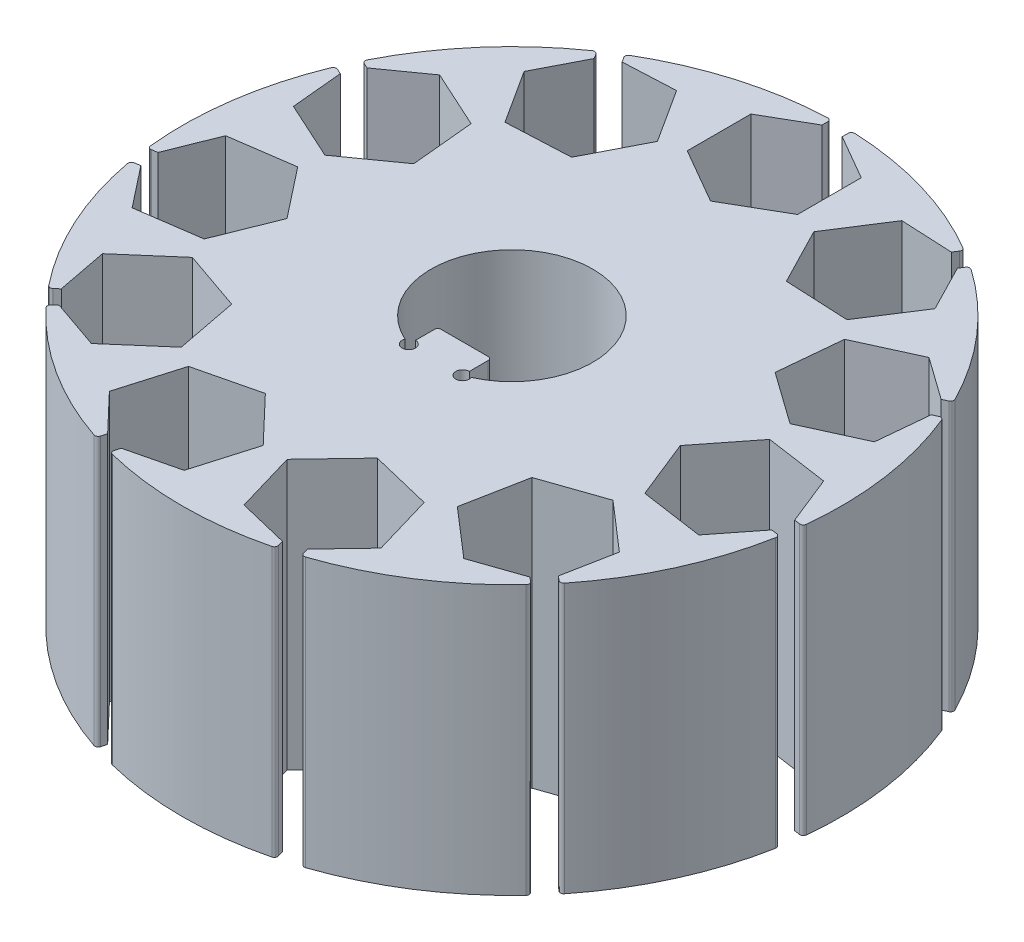
from build123d import *

# Parameters (mm, degrees)
SKETCH1_R                = 24.5
BOSS_EXTRUDE1_DEPTH      = 20
CUT_EXTRUDE1_DEPTH       = 41.006249512
FILLET1_R                = 0.25
CIRPATTERN1_COUNT        = 11
FILLET1_OF_CIRPATTERN1_R = 0.25
FILLET2_R                = 0.25


with BuildPart() as part:
    # Sketch1 → Boss-Extrude1 (new body)
    with BuildSketch(Plane(origin=(0, 0, 0), x_dir=(1, 0, 0), z_dir=(0, 1, 0))):
        with Locations(Location((0, 0, 0), (0, 0, 270))):
            Circle(SKETCH1_R)
        with BuildLine():
            Line((2, -5.167459748), (2, -3.51))
            Line((2, -3.51), (-2, -3.51))
            Line((-2, -3.51), (-2, -5.167459748))
            ThreePointArc((-2, -5.167459748), (-1.7197584, -6.081542645), (-2.464173015, -5.481601167))
            ThreePointArc((-2.464173015, -5.481601167), (0, 6.01), (2.464173015, -5.481601167))
            ThreePointArc((2.464173015, -5.481601167), (1.7197584, -6.081542645), (2, -5.167459748))
        make_face(mode=Mode.SUBTRACT)
    extrude(amount=BOSS_EXTRUDE1_DEPTH)

    # Sketch3 → Cut-Extrude1 (cut, through all)
    with BuildSketch(Plane(origin=(0, 20, 0), x_dir=(1, 0, 0), z_dir=(0, 1, 0))):
        Polygon((0.75, 23.801259505), (0.75, 24.5), (-0.75, 24.5), (-0.75, 23.801259505), (-4.1, 21.867136104), (-4.1, 17.132863896), (0, 14.765727793), (4.1, 17.132863896), (4.1, 21.867136104), align=None)
    cut_extrude1 = extrude(amount=-CUT_EXTRUDE1_DEPTH, mode=Mode.SUBTRACT)

    # Fillet1
    fillet1_edges = [part.edges().sort_by_distance(p)[0] for p in [
        (0.75, 10, -24.488517717),
        (-0.75, 10, -24.488517717),
    ]]
    fillet(fillet1_edges, radius=FILLET1_R)

    # CirPattern1: Cut-Extrude1 ×11 about axis
    cirpattern1_axis = Axis((0, 0, 0), (0, 1, 0))
    for i in range(1, CIRPATTERN1_COUNT):
        add(cut_extrude1.rotate(cirpattern1_axis, i * 360 / CIRPATTERN1_COUNT), mode=Mode.SUBTRACT)

    # Fillet1 of CirPattern1
    fillet1_of_cirpattern1_edges = [part.edges().sort_by_distance(p)[0] for p in [
        (-12.608552087, 10, -21.006532657),
        (-13.870432387, 10, -20.195571431),
        (-21.963977975, 10, -10.855121903),
        (-22.587100494, 10, -9.490673909),
        (-24.345996045, 10, 2.742713357),
        (-24.132523788, 10, 4.22744552),
        (-18.998332392, 10, 15.469756505),
        (-18.016041291, 10, 16.603380866),
        (-7.61883244, 10, 23.285261267),
        (-6.17959298, 10, 23.707860102),
        (6.17959298, 10, 23.707860102),
        (7.61883244, 10, 23.285261267),
        (18.016041291, 10, 16.603380866),
        (18.998332392, 10, 15.469756505),
        (24.132523788, 10, 4.22744552),
        (24.345996045, 10, 2.742713357),
        (22.587100494, 10, -9.490673909),
        (21.963977975, 10, -10.855121903),
        (13.870432387, 10, -20.195571431),
        (12.608552087, 10, -21.006532657),
    ]]
    fillet(fillet1_of_cirpattern1_edges, radius=FILLET1_OF_CIRPATTERN1_R)

    # Fillet2
    fillet2_edges = [part.edges().sort_by_distance(p)[0] for p in [
        (-2, 10, 3.51),
        (2, 10, 3.51),
    ]]
    fillet(fillet2_edges, radius=FILLET2_R)


solid = part.part
